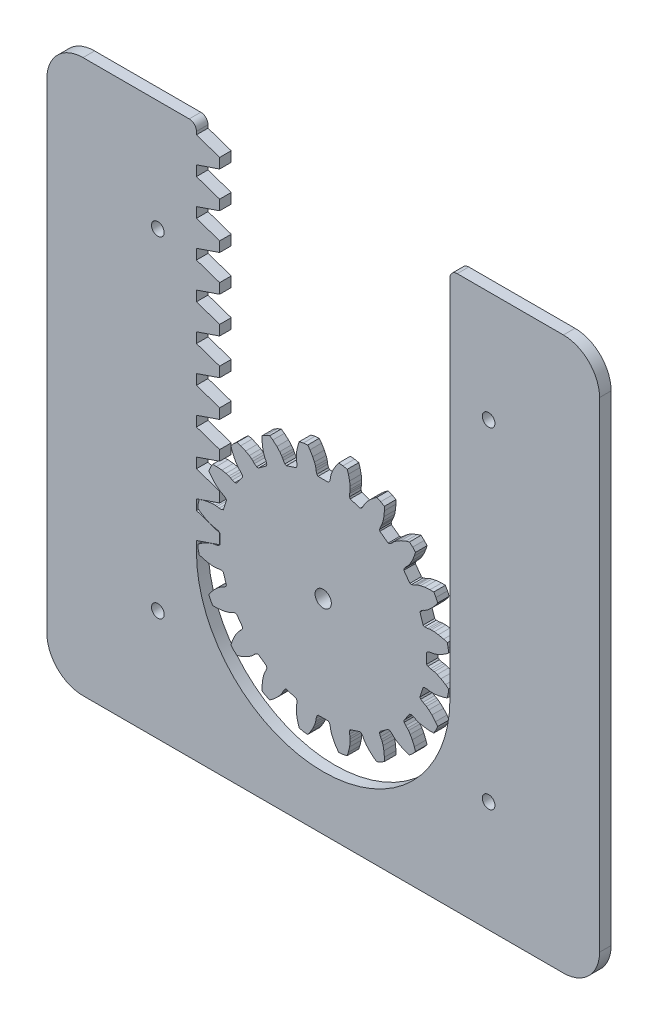
from build123d import *

# Parameters (mm, degrees)
SKETCH5_R           = 35
SKETCH5_R_2         = 2.25
BOSS_EXTRUDE1_DEPTH = 3.2
CUT_EXTRUDE1_DEPTH  = 76.509079187
CIRPATTERN1_COUNT   = 20
SKETCH6_R           = 1.75
BOSS_EXTRUDE3_DEPTH = 3.2


with BuildPart() as part:
    # Sketch5 → Boss-Extrude1 (new body)
    with BuildSketch(Plane.XY):
        with Locations((31.830988618, 0)):
            Circle(SKETCH5_R)
        with Locations((31.830988618, 0)):
            Circle(SKETCH5_R_2, mode=Mode.SUBTRACT)
    extrude(amount=BOSS_EXTRUDE1_DEPTH)

    # tooth_cut → Cut-Extrude1 (cut, through all)
    with BuildSketch(Plane.XY):
        with BuildLine():
            Line((3.233098862, 1.420819508), (3.233098862, -1.420819508))
            Line((3.233098862, -1.420819508), (2.892816804, -1.738815626))
            Line((2.892816804, -1.738815626), (2.176548442, -1.964919585))
            Line((2.176548442, -1.964919585), (1.599751534, -2.03453298))
            Line((1.599751534, -2.03453298), (1.113754294, -2.145678041))
            Line((1.113754294, -2.145678041), (0.329242102, -2.413997013))
            Line((0.329242102, -2.413997013), (-0.722824385, -2.901942124))
            Line((-0.722824385, -2.901942124), (-2.001840326, -3.666863287))
            Line((-2.001840326, -3.666863287), (-2.844736069, -4.299306919))
            Line((-2.844736069, -4.299306919), (-2.738103302, -5.475206276))
            ThreePointArc((-2.738103302, -5.475206276), (-3.169011382, 0), (-2.738103302, 5.475206276))
            Line((-2.738103302, 5.475206276), (-2.844736069, 4.299306919))
            Line((-2.844736069, 4.299306919), (-2.001840326, 3.666863287))
            Line((-2.001840326, 3.666863287), (-0.722824385, 2.901942124))
            Line((-0.722824385, 2.901942124), (0.329242102, 2.413997013))
            Line((0.329242102, 2.413997013), (1.113754294, 2.145678041))
            Line((1.113754294, 2.145678041), (1.599751534, 2.03453298))
            Line((1.599751534, 2.03453298), (2.176548442, 1.964919585))
            Line((2.176548442, 1.964919585), (2.892816804, 1.738815626))
            Line((2.892816804, 1.738815626), (3.233098862, 1.420819508))
        make_face()
    cut_extrude1 = extrude(amount=CUT_EXTRUDE1_DEPTH, mode=Mode.SUBTRACT)

    # CirPattern1: Cut-Extrude1 ×20 about axis
    cirpattern1_axis = Axis((31.830988618, 0, 0), (0, 0, 1))
    for i in range(1, CIRPATTERN1_COUNT):
        add(cut_extrude1.rotate(cirpattern1_axis, i * 360 / CIRPATTERN1_COUNT), mode=Mode.SUBTRACT)


with BuildPart() as body_2:
    # Sketch6 → Boss-Extrude3 (new body)
    with BuildSketch(Plane.XY):
        with BuildLine():
            Line((-34.608572408, -56.471604766), (98.270549645, -56.471604766))
            ThreePointArc((98.270549645, -56.471604766), (105.341617456, -53.542672578), (108.270549645, -46.471604766))
            Line((108.270549645, -46.471604766), (108.270549645, 86.407517286))
            ThreePointArc((108.270549645, 86.407517286), (105.341617456, 93.478585098), (98.270549645, 96.407517286))
            Line((98.270549645, 96.407517286), (68.895076099, 96.407517286))
            ThreePointArc((68.895076099, 96.407517286), (67.480862536, 95.821730848), (66.895076099, 94.407517286))
            Line((66.895076099, 94.407517286), (66.895076099, -6.407517286))
            ThreePointArc((66.895076099, -6.407517286), (31.830988618, -41.471604766), (-3.233098862, -6.407517286))
            Line((-3.233098862, -6.407517286), (-3.233098862, -3.592482714))
            Line((-3.233098862, -3.592482714), (3.183098862, -1.398013849))
            Line((3.183098862, -1.398013849), (3.183098862, 1.398013849))
            Line((3.183098862, 1.398013849), (-3.233098862, 3.592482714))
            Line((-3.233098862, 3.592482714), (-3.233098862, 6.407517286))
            Line((-3.233098862, 6.407517286), (3.183098862, 8.601986151))
            Line((3.183098862, 8.601986151), (3.183098862, 11.398013849))
            Line((3.183098862, 11.398013849), (-3.233098862, 13.592482714))
            Line((-3.233098862, 13.592482714), (-3.233098862, 16.407517286))
            Line((-3.233098862, 16.407517286), (3.183098862, 18.601986151))
            Line((3.183098862, 18.601986151), (3.183098862, 21.398013849))
            Line((3.183098862, 21.398013849), (-3.233098862, 23.592482714))
            Line((-3.233098862, 23.592482714), (-3.233098862, 26.407517286))
            Line((-3.233098862, 26.407517286), (3.183098862, 28.601986151))
            Line((3.183098862, 28.601986151), (3.183098862, 31.398013849))
            Line((3.183098862, 31.398013849), (-3.233098862, 33.592482714))
            Line((-3.233098862, 33.592482714), (-3.233098862, 36.407517286))
            Line((-3.233098862, 36.407517286), (3.183098862, 38.601986151))
            Line((3.183098862, 38.601986151), (3.183098862, 41.398013849))
            Line((3.183098862, 41.398013849), (-3.233098862, 43.592482714))
            Line((-3.233098862, 43.592482714), (-3.233098862, 46.407517286))
            Line((-3.233098862, 46.407517286), (3.183098862, 48.601986151))
            Line((3.183098862, 48.601986151), (3.183098862, 51.398013849))
            Line((3.183098862, 51.398013849), (-3.233098862, 53.592482714))
            Line((-3.233098862, 53.592482714), (-3.233098862, 56.407517286))
            Line((-3.233098862, 56.407517286), (3.183098862, 58.601986151))
            Line((3.183098862, 58.601986151), (3.183098862, 61.398013849))
            Line((3.183098862, 61.398013849), (-3.233098862, 63.592482714))
            Line((-3.233098862, 63.592482714), (-3.233098862, 66.407517286))
            Line((-3.233098862, 66.407517286), (3.183098862, 68.601986151))
            Line((3.183098862, 68.601986151), (3.183098862, 71.398013849))
            Line((3.183098862, 71.398013849), (-3.233098862, 73.592482714))
            Line((-3.233098862, 73.592482714), (-3.233098862, 76.407517286))
            Line((-3.233098862, 76.407517286), (3.183098862, 78.601986151))
            Line((3.183098862, 78.601986151), (3.183098862, 81.398013849))
            Line((3.183098862, 81.398013849), (-3.233098862, 83.592482714))
            Line((-3.233098862, 83.592482714), (-3.233098862, 86.407517286))
            Line((-3.233098862, 86.407517286), (3.183098862, 88.601986151))
            Line((3.183098862, 88.601986151), (3.183098862, 91.398013849))
            Line((3.183098862, 91.398013849), (-3.233098862, 93.592482714))
            Line((-3.233098862, 93.592482714), (-3.233098862, 94.407517286))
            ThreePointArc((-3.233098862, 94.407517286), (-3.818885299, 95.821730848), (-5.233098862, 96.407517286))
            Line((-5.233098862, 96.407517286), (-34.608572408, 96.407517286))
            ThreePointArc((-34.608572408, 96.407517286), (-41.67964022, 93.478585098), (-44.608572408, 86.407517286))
            Line((-44.608572408, 86.407517286), (-44.608572408, -46.471604766))
            ThreePointArc((-44.608572408, -46.471604766), (-41.67964022, -53.542672578), (-34.608572408, -56.471604766))
        make_face()
        with Locations((77.582812872, 65.719780513)):
            Circle(SKETCH6_R, mode=Mode.SUBTRACT)
        with Locations(Location((77.582812872, -25.783867993, 0), (0, 0, 180))):
            Circle(SKETCH6_R, mode=Mode.SUBTRACT)
        with Locations(Location((-13.920835635, 65.719780513, 0), (0, 0, 180))):
            Circle(SKETCH6_R, mode=Mode.SUBTRACT)
        with Locations((-13.920835635, -25.783867993)):
            Circle(SKETCH6_R, mode=Mode.SUBTRACT)
    extrude(amount=BOSS_EXTRUDE3_DEPTH)


solid = Compound([part.part, body_2.part])
